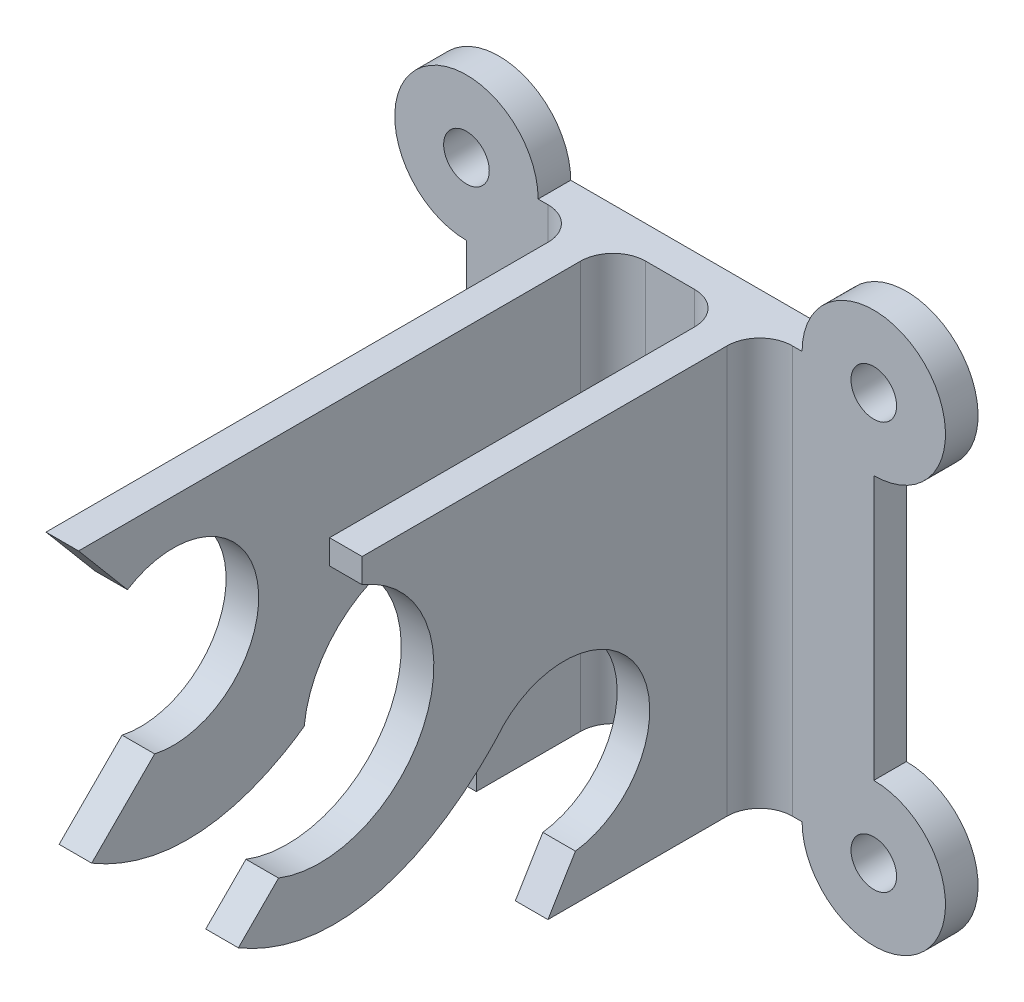
from build123d import *

# Parameters (mm, degrees)
SKETCH1_W             = 7
SKETCH1_H             = 25
BOSS_EXTRUDE1_DEPTH   = 2
SKETCH1_R             = 1.4
BOSS_EXTRUDE1_2_DEPTH = 2
BOSS_EXTRUDE1_3_DEPTH = 2
SKETCH1_3_W           = 2
SKETCH1_3_H           = 25
BOSS_EXTRUDE2_DEPTH   = 40
CUT_EXTRUDE12_REACH   = 56.462
SKETCH2_R             = 5.25
SKETCH2_R_2           = 7
CUT_EXTRUDE13_REACH   = 56.462
SKETCH3_R             = 5.25
SKETCH3_R_2           = 7
CUT_EXTRUDE14_DEPTH   = 55.462096912
CUT_EXTRUDE15_REACH   = 52.769
SKETCH6_W             = 4.605551275
SKETCH6_H             = 2
CUT_EXTRUDE16_REACH   = 52.769
FILLET1_R             = 2


with BuildPart() as part:
    # Sketch1 → Boss-Extrude1 (new body)
    with BuildSketch(Plane.XY):
        with Locations((12.5, 12.5)):
            Rectangle(SKETCH1_W, SKETCH1_H)
    extrude(amount=BOSS_EXTRUDE1_DEPTH)



with BuildPart() as body_2:
    # Sketch1 → Boss-Extrude1 2 (new body)
    with BuildSketch(Plane.XY):
        with BuildLine():
            Line((7, 0), (7, 25))
            Line((7, 25), (4.4, 25))
            ThreePointArc((4.4, 25), (-3.111269837, 28.111269837), (0, 20.6))
            Line((0, 20.6), (0, 4.4))
            ThreePointArc((0, 4.4), (-3.111269837, -3.111269837), (4.4, 0))
            Line((4.4, 0), (7, 0))
        make_face()
        Circle(SKETCH1_R, mode=Mode.SUBTRACT)
        with Locations((0, 25)):
            Circle(SKETCH1_R, mode=Mode.SUBTRACT)
    extrude(amount=BOSS_EXTRUDE1_2_DEPTH)


with BuildPart() as body_3:
    # Sketch1 → Boss-Extrude1 3 (new body)
    with BuildSketch(Plane.XY):
        with BuildLine():
            Line((20.6, 25), (18, 25))
            Line((18, 25), (18, 0))
            Line((18, 0), (20.6, 0))
            ThreePointArc((20.6, 0), (28.111269837, -3.111269837), (25, 4.4))
            Line((25, 4.4), (25, 20.6))
            ThreePointArc((25, 20.6), (28.111269837, 28.111269837), (20.6, 25))
        make_face()
        with Locations((25, 25)):
            Circle(SKETCH1_R, mode=Mode.SUBTRACT)
        with Locations((25, 0)):
            Circle(SKETCH1_R, mode=Mode.SUBTRACT)
    extrude(amount=BOSS_EXTRUDE1_3_DEPTH)


with BuildPart() as part_1:
    add(part.part)

    add(body_2.part)  # Boss-Extrude2 merges body 2

    add(body_3.part)  # Boss-Extrude2 merges body 3
    # Sketch1<3> → Boss-Extrude2 (add)
    with BuildSketch(Plane.XY):
        with Locations((8, 12.5)):
            Rectangle(SKETCH1_3_W, SKETCH1_3_H)
        with Locations((17, 12.5)):
            Rectangle(SKETCH1_3_W, SKETCH1_3_H)
    extrude(amount=BOSS_EXTRUDE2_DEPTH)

    # Sketch2 → Cut-Extrude12 (cut, up to next)
    with BuildSketch(Plane.ZY.offset(-7), mode=Mode.PRIVATE) as cut_extrude12_sk1:
        with Locations((29, 17)):
            Circle(SKETCH2_R)
    cut_extrude12_tool1 = extrude(cut_extrude12_sk1.sketch, amount=-CUT_EXTRUDE12_REACH, mode=Mode.PRIVATE) & part_1.part
    # Sketch2 → Cut-Extrude12 (cut, up to next)
    with BuildSketch(Plane.ZY.offset(-7), mode=Mode.PRIVATE) as cut_extrude12_sk2:
        with Locations((14, 8)):
            Circle(SKETCH2_R_2)
    cut_extrude12_tool2 = extrude(cut_extrude12_sk2.sketch, amount=-CUT_EXTRUDE12_REACH, mode=Mode.PRIVATE) & part_1.part
    add(cut_extrude12_tool1.solids().sort_by_distance((7, 17, 29))[0], mode=Mode.SUBTRACT)
    add(cut_extrude12_tool2.solids().sort_by_distance((7, 8, 14))[0], mode=Mode.SUBTRACT)

    # Sketch3 → Cut-Extrude13 (cut, up to next)
    with BuildSketch(Plane(origin=(18, 0, 0), x_dir=(0, 0, -1), z_dir=(1, 0, 0)), mode=Mode.PRIVATE) as cut_extrude13_sk1:
        with Locations((-14, 8)):
            Circle(SKETCH3_R)
    cut_extrude13_tool1 = extrude(cut_extrude13_sk1.sketch, amount=-CUT_EXTRUDE13_REACH, mode=Mode.PRIVATE) & part_1.part
    # Sketch3 → Cut-Extrude13 (cut, up to next)
    with BuildSketch(Plane(origin=(18, 0, 0), x_dir=(0, 0, -1), z_dir=(1, 0, 0)), mode=Mode.PRIVATE) as cut_extrude13_sk2:
        with Locations((-29, 17)):
            Circle(SKETCH3_R_2)
    cut_extrude13_tool2 = extrude(cut_extrude13_sk2.sketch, amount=-CUT_EXTRUDE13_REACH, mode=Mode.PRIVATE) & part_1.part
    add(cut_extrude13_tool1.solids().sort_by_distance((18, 8, 14))[0], mode=Mode.SUBTRACT)
    add(cut_extrude13_tool2.solids().sort_by_distance((18, 17, 29))[0], mode=Mode.SUBTRACT)

    # Sketch5 → Cut-Extrude14 (cut, through all)
    with BuildSketch(Plane.ZY.offset(-7)):
        with BuildLine():
            Line((31.804811412, 21.437964955), (34.804811412, 25))
            Line((34.804811412, 25), (40, 25))
            Line((40, 25), (40, 0))
            Line((40, 0), (15, 0))
            Line((15, 0), (13.312046989, 2.795269397))
            Line((13.312046989, 2.795269397), (18.15476351, 11.209429883))
            add(Edge.make_bspline(
                [(34, 8), (28.19172845, 4.568111712), (22.349790319, 6.720692965), (18.15476351, 11.209429883)],
                knots=[0, 0, 0, 0, 1, 1, 1, 1], degree=3))
            Line((34, 8), (30.135621564, 11.874293838))
            Line((30.135621564, 11.874293838), (31.804811412, 21.437964955))
        make_face()
    extrude(amount=-CUT_EXTRUDE14_DEPTH, mode=Mode.SUBTRACT)

    # Sketch6 → Cut-Extrude15 (cut, up to next)
    with BuildSketch(Plane.ZY.offset(-7), mode=Mode.PRIVATE) as cut_extrude15_sk1:
        with Locations((12.697224363, 1)):
            Rectangle(SKETCH6_W, SKETCH6_H)
    cut_extrude15_tool1 = extrude(cut_extrude15_sk1.sketch, amount=-CUT_EXTRUDE15_REACH, mode=Mode.PRIVATE) & part_1.part
    add(cut_extrude15_tool1.solids().sort_by_distance((7, 1, 12.697224))[0], mode=Mode.SUBTRACT)

    # Sketch7 → Cut-Extrude16 (cut, up to next)
    with BuildSketch(Plane(origin=(18, 0, 0), x_dir=(0, 0, -1), z_dir=(1, 0, 0)), mode=Mode.PRIVATE) as cut_extrude16_sk1:
        with BuildLine():
            Line((-34.804811412, 25), (-26.401923789, 25))
            Line((-26.401923789, 25), (-26.401923789, 23.5))
            ThreePointArc((-26.401923789, 23.5), (-30.6033676, 19.298556189), (-34.804811412, 23.5))
            Line((-34.804811412, 23.5), (-34.804811412, 25))
        make_face()
    cut_extrude16_tool1 = extrude(cut_extrude16_sk1.sketch, amount=-CUT_EXTRUDE16_REACH, mode=Mode.PRIVATE) & part_1.part
    add(cut_extrude16_tool1.solids().sort_by_distance((18, 22.508493, 30.603368))[0], mode=Mode.SUBTRACT)

    # Fillet1
    fillet1_edges = [part_1.edges().sort_by_distance(p)[0] for p in [
        (18, 12.5, 2),
        (16, 12.5, 2),
        (9, 12.5, 2),
        (7, 12.5, 2),
    ]]
    fillet(fillet1_edges, radius=FILLET1_R)


solid = part_1.part
